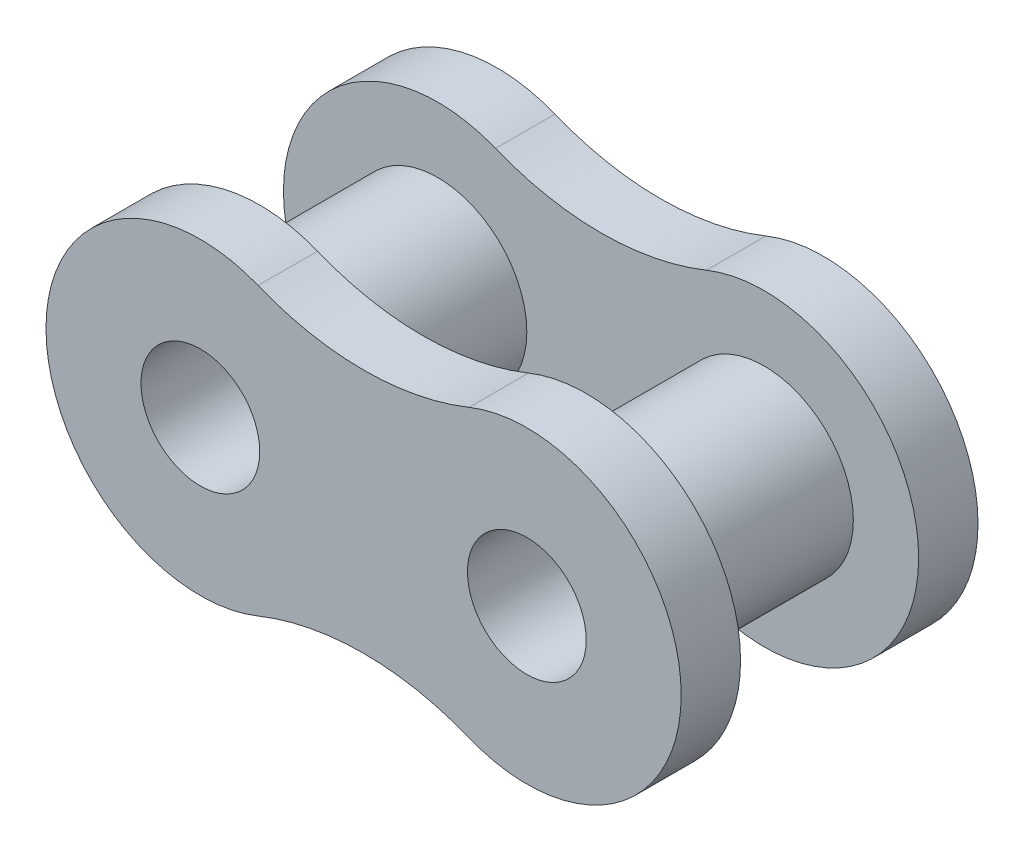
from build123d import *

# Parameters (mm, degrees)
SKETCH1_R           = 1
BOSS_EXTRUDE1_DEPTH = 1
BOSS_EXTRUDE2_START = -5
SKETCH2_R           = 1.5
SKETCH2_R_2         = 1
BOSS_EXTRUDE2_DEPTH = 5


with BuildPart() as part:
    # Sketch1 → Boss-Extrude1 (new body)
    with BuildSketch(Plane.XY):
        with BuildLine():
            ThreePointArc((-34.811060782, 2.411157676), (-38.383849898, 0), (-34.811060782, -2.411157676))
            ThreePointArc((-34.811060782, -2.411157676), (-33.033849898, -2.066157275), (-31.256639013, -2.411157676))
            ThreePointArc((-31.256639013, -2.411157676), (-27.683849898, 0), (-31.256639013, 2.411157676))
            ThreePointArc((-31.256639013, 2.411157676), (-33.033849898, 2.066157275), (-34.811060782, 2.411157676))
        make_face()
        with Locations((-35.783849898, 0)):
            Circle(SKETCH1_R, mode=Mode.SUBTRACT)
        with Locations((-30.283849898, 0)):
            Circle(SKETCH1_R, mode=Mode.SUBTRACT)
    extrude(amount=BOSS_EXTRUDE1_DEPTH)


with BuildPart() as body_2:
    # Mirror2: mirrored copy
    add(part.part.mirror(Plane(origin=(0, 0, -1.5), x_dir=(1, 0, 0), z_dir=(0, 0, -1))))


with BuildPart() as part_1:
    add(part.part)

    add(body_2.part)  # Boss-Extrude2 merges body 2
    # Sketch2 → Boss-Extrude2 (add)
    # profile 1 of 2: a face of its own
    with BuildSketch(Plane.XY.offset(1).offset(BOSS_EXTRUDE2_START)):
        with Locations((-30.283849898, 0)):
            Circle(SKETCH2_R)
        with Locations((-30.283849898, 0)):
            Circle(SKETCH2_R_2, mode=Mode.SUBTRACT)
    # profile 2 of 2: a face of its own
    with BuildSketch(Plane.XY.offset(1).offset(BOSS_EXTRUDE2_START)):
        with Locations((-35.783849898, 0)):
            Circle(SKETCH2_R)
        with Locations((-35.783849898, 0)):
            Circle(SKETCH2_R_2, mode=Mode.SUBTRACT)
    extrude(amount=BOSS_EXTRUDE2_DEPTH)


solid = part_1.part
